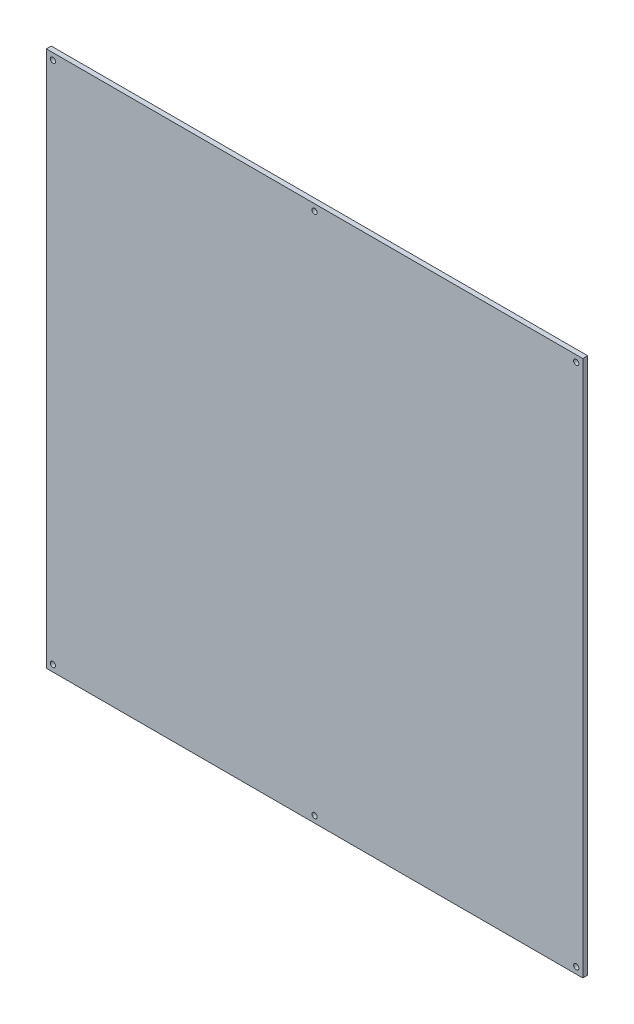
from build123d import *

# Parameters (mm, degrees)
CROQUIS1_W              = 328
CROQUIS1_H              = 328
SALIENTE_EXTRUIR1_DEPTH = 3
CROQUIS2_R              = 1.6
CORTAR_EXTRUIR1_DEPTH   = 3


with BuildPart() as part:
    # Croquis1 → Saliente-Extruir1 (new body)
    with BuildSketch(Plane.XY):
        with Locations((164, 164)):
            Rectangle(CROQUIS1_W, CROQUIS1_H)
    extrude(amount=SALIENTE_EXTRUIR1_DEPTH)

    # Croquis2 → Cortar-Extruir1 (cut)
    with BuildSketch(Plane.XY.offset(3)):
        with Locations((4, 324)):
            Circle(CROQUIS2_R)
        with Locations((164, 324)):
            Circle(CROQUIS2_R)
        with Locations((324, 324)):
            Circle(CROQUIS2_R)
        with Locations(Location((324, 4, 0), (0, 0, 180))):
            Circle(CROQUIS2_R)
        with Locations(Location((164, 4, 0), (0, 0, 180))):
            Circle(CROQUIS2_R)
        with Locations(Location((4, 4, 0), (0, 0, 180))):
            Circle(CROQUIS2_R)
    extrude(amount=-CORTAR_EXTRUIR1_DEPTH, mode=Mode.SUBTRACT)


solid = part.part
